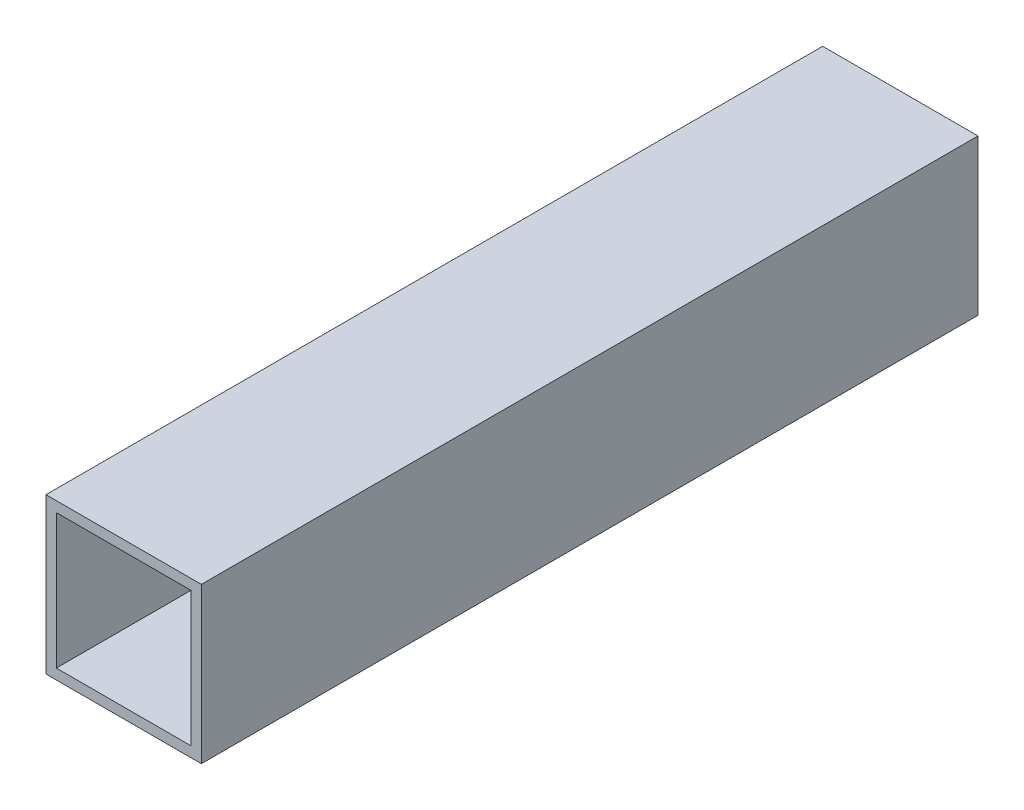
from build123d import *

# Parameters (mm, degrees)
CROQUIS1_W            = 30
CROQUIS1_H            = 30
CROQUIS1_W_2          = 26
CROQUIS1_H_2          = 26
EXTRUIR_L_MINA1_DEPTH = 150


with BuildPart() as part:
    # Croquis1 → Extruir-Lámina1 (new body)
    with BuildSketch(Plane.XY):
        Rectangle(CROQUIS1_W, CROQUIS1_H)
        Rectangle(CROQUIS1_W_2, CROQUIS1_H_2, mode=Mode.SUBTRACT)
    extrude(amount=EXTRUIR_L_MINA1_DEPTH)


solid = part.part
